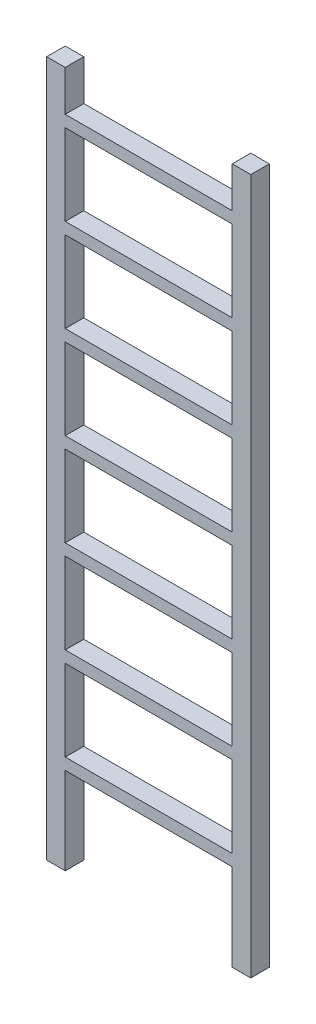
from build123d import *

# Parameters (mm, degrees)
SKETCH_1_W      = 80
SKETCH_1_H      = 3000
EXTRUDE_1_DEPTH = 80
SKETCH_2_W      = 80
SKETCH_2_H      = 3000
EXTRUDE_2_DEPTH = 80
SKETCH_3_W      = 800
SKETCH_3_H      = 50
EXTRUDE_3_DEPTH = 80
SKETCH_4_W      = 800
SKETCH_4_H      = 50
EXTRUDE_4_DEPTH = 80
SKETCH_5_W      = 800
SKETCH_5_H      = 50
EXTRUDE_5_DEPTH = 80
SKETCH_6_W      = 800
SKETCH_6_H      = 50
EXTRUDE_6_DEPTH = 80
SKETCH_7_W      = 800
SKETCH_7_H      = 50
EXTRUDE_7_DEPTH = 80
SKETCH_8_W      = 800
SKETCH_8_H      = 50
EXTRUDE_8_DEPTH = 80
SKETCH_9_W      = 800
SKETCH_9_H      = 50
EXTRUDE_9_DEPTH = 80


with BuildPart() as part:
    # 草图1 → 凸台-拉伸1 (new body)
    with BuildSketch(Plane.XY):
        with Locations((-400, 0)):
            Rectangle(SKETCH_1_W, SKETCH_1_H)
    extrude(amount=EXTRUDE_1_DEPTH)



with BuildPart() as body_2:
    # 草图2 → 凸台-拉伸2 (new body)
    with BuildSketch(Plane.XY):
        with Locations((400, 0)):
            Rectangle(SKETCH_2_W, SKETCH_2_H)
    extrude(amount=EXTRUDE_2_DEPTH)


with BuildPart() as part_1:
    add(part.part)

    add(body_2.part)  # 凸台-拉伸3 merges body 2
    # 草图3 → 凸台-拉伸3 (add)
    with BuildSketch(Plane.XY):
        with Locations((0, 1300)):
            Rectangle(SKETCH_3_W, SKETCH_3_H)
    extrude(amount=EXTRUDE_3_DEPTH)

    # 草图4 → 凸台-拉伸4 (add)
    with BuildSketch(Plane.XY):
        with Locations((0, 900)):
            Rectangle(SKETCH_4_W, SKETCH_4_H)
    extrude(amount=EXTRUDE_4_DEPTH)

    # 草图5 → 凸台-拉伸5 (add)
    with BuildSketch(Plane.XY):
        with Locations((0, 500)):
            Rectangle(SKETCH_5_W, SKETCH_5_H)
    extrude(amount=EXTRUDE_5_DEPTH)

    # 草图6 → 凸台-拉伸6 (add)
    with BuildSketch(Plane.XY):
        with Locations((0, 100)):
            Rectangle(SKETCH_6_W, SKETCH_6_H)
    extrude(amount=EXTRUDE_6_DEPTH)

    # 草图7 → 凸台-拉伸7 (add)
    with BuildSketch(Plane.XY):
        with Locations((0, -300)):
            Rectangle(SKETCH_7_W, SKETCH_7_H)
    extrude(amount=EXTRUDE_7_DEPTH)

    # 草图8 → 凸台-拉伸8 (add)
    with BuildSketch(Plane.XY):
        with Locations((0, -700)):
            Rectangle(SKETCH_8_W, SKETCH_8_H)
    extrude(amount=EXTRUDE_8_DEPTH)

    # 草图9 → 凸台-拉伸9 (add)
    with BuildSketch(Plane.XY):
        with Locations((0, -1100)):
            Rectangle(SKETCH_9_W, SKETCH_9_H)
    extrude(amount=EXTRUDE_9_DEPTH)


solid = part_1.part
